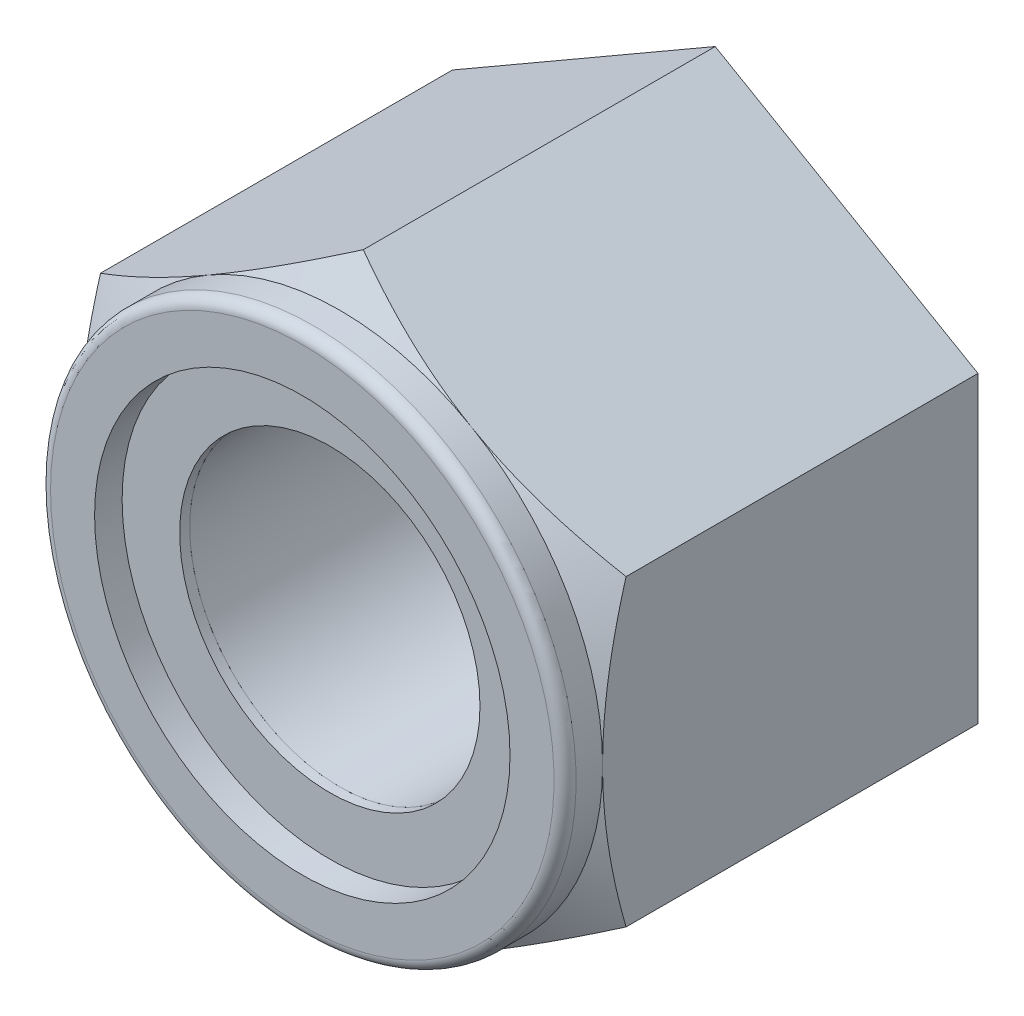
from build123d import *

# Parameters (mm, degrees)
EXTRUDE1_DEPTH     = 5
SKETCH5_R          = 3.133333333
SKETCH5_R_2        = 2
EXTRUDE2_DEPTH     = 0.133333333
SKETCH4_R          = 2
CUT_EXTRUDE1_DEPTH = 8.670288999
FILLET2_R          = 0.146666667


with BuildPart() as part:
    # Sketch1 → Extrude1 (new body)
    with BuildSketch(Plane.XY):
        Polygon((0, 4.041451884), (-3.5, 2.020725942), (-3.5, -2.020725942), (0, -4.041451884), (3.5, -2.020725942), (3.5, 2.020725942), align=None)
    extrude(amount=EXTRUDE1_DEPTH)

    # Sketch2 → Cut-Revolve1 (revolve, cut)
    with BuildSketch(Plane(origin=(0, 0, 0), x_dir=(1, 0, 0), z_dir=(0, 1, 0))):
        Polygon((3.5, -5), (4.9, -5), (4.9, -4.191709623), align=None)
    revolve(axis=Axis((0, 0, 0), (0, 0, 1)), mode=Mode.SUBTRACT)

    # Sketch3 → Revolve1 (revolve)
    with BuildSketch(Plane(origin=(0, 0, 0), x_dir=(1, 0, 0), z_dir=(0, 1, 0)), mode=Mode.PRIVATE) as revolve1_sk:
        Polygon((3.5, -5), (3.5, -5.5), (2.766666667, -5.5), (2.766666667, -5.133333333), (3.133333333, -5.133333333), (3.133333333, -5), align=None)
    revolve(revolve1_sk.sketch.rotate(Axis((0, 0, 0), (0, 0, 1)), 180), axis=Axis((0, 0, 0), (0, 0, 1)))

    # Sketch4 → Cut-Extrude1 (cut, through all)
    with BuildSketch(Plane(origin=(0, 0, 0), x_dir=(-1, 0, 0), z_dir=(0, 0, -1))):
        with Locations(Location((0, 0, 0), (0, 0, 180))):
            Circle(SKETCH4_R)
    extrude(amount=-CUT_EXTRUDE1_DEPTH, mode=Mode.SUBTRACT)

    # Fillet2
    fillet2_edges = [part.edges().sort_by_distance(p)[0] for p in [
        (3.5, 0, 5.5),
    ]]
    fillet(fillet2_edges, radius=FILLET2_R)


with BuildPart() as body_2:
    # Sketch5 → Extrude2 (new body)
    with BuildSketch(Plane.XY.offset(5)):
        Circle(SKETCH5_R)
        Circle(SKETCH5_R_2, mode=Mode.SUBTRACT)
    extrude(amount=EXTRUDE2_DEPTH)


solid = Compound([part.part, body_2.part])
